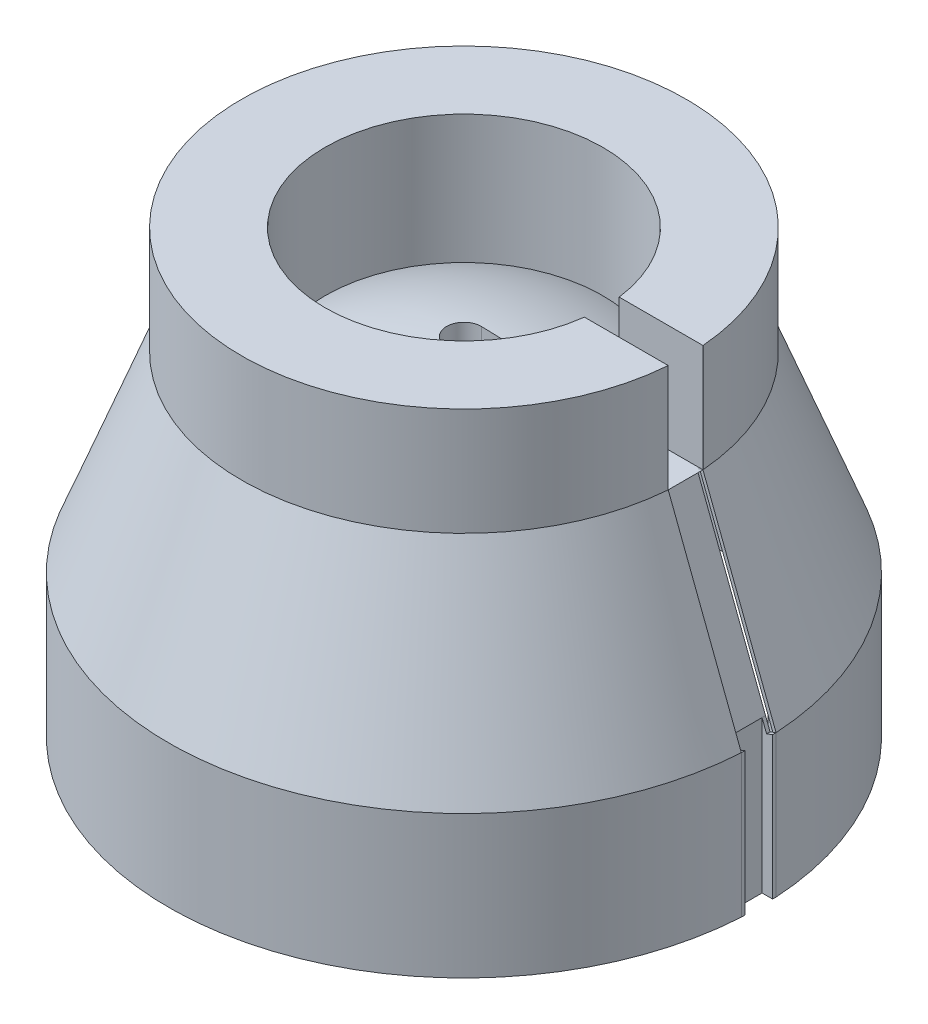
from build123d import *

# Parameters (mm, degrees)
DOME4_FACE_RADIUS        = 40
DOME4_HEIGHT             = 10
SKETCH4_R                = 5
SKETCH4_R_2              = 2.5
BOSS_EXTRUDE1_DEPTH      = 45
CIRPATTERN1_COUNT        = 4
SKETCH5_W                = 10
SKETCH5_H                = 31
CUT_EXTRUDE2_DEPTH       = 89.861003778
SKETCH6_W                = 24.118118898
SKETCH6_H                = 31
BOSS_EXTRUDE2_DEPTH      = 0.1
SKETCH7_W                = 24.118118898
SKETCH7_H                = 31
BOSS_EXTRUDE3_DEPTH      = 0.1
SKETCH8_W                = 45.166544076
SKETCH8_H                = 10
BOSS_EXTRUDE5_DEPTH      = 96
CUT_EXTRUDE13_DEPTH      = 20
SKETCH12_W               = 3.037052207
SKETCH12_H               = 10
CUT_EXTRUDE15_DEPTH      = 190
SKETCH13_W               = 10
SKETCH13_H               = 96
CUT_EXTRUDE16_DEPTH      = 190
BOSS_EXTRUDE7_DEPTH      = 1
BOSS_EXTRUDE9_DEPTH      = 1
CUT_EXTRUDE17_DEPTH      = 31
CUT_EXTRUDE17_DEPTH_BACK = 2
SKETCH17_W               = 10
SKETCH17_H               = 58.890017455
SKETCH18_R               = 5
CUT_EXTRUDE18_DEPTH      = 42
SKETCH19_R               = 33.381211514
SKETCH19_R_2             = 30.278223776
BOSS_EXTRUDE10_DEPTH     = 5
FILLET2_R                = 1


with BuildPart() as part:
    # Sketch1 → Revolve1 (revolve)
    with BuildSketch(Plane.XY, mode=Mode.PRIVATE) as revolve1_sk:
        Polygon((85, 0), (85, 41), (64, 96), (64, 127), (40, 127), (40, 90), (0, 90), (0, 89), (41, 89), (41, 126), (63, 126), (63, 95.815583613), (84, 40.815583613), (84, 0), align=None)
    revolve(revolve1_sk.sketch.rotate(Axis((0, 90, 0), (0, -1, 0)), 180), axis=Axis((0, 90, 0), (0, -1, 0)))

    # Dome4: a dome of height H over a round flat face of radius A is a cap of a sphere of radius (A * A + H * H) / (2 * H)
    dome4_r = (DOME4_FACE_RADIUS * DOME4_FACE_RADIUS + DOME4_HEIGHT * DOME4_HEIGHT) / (2 * DOME4_HEIGHT)
    dome4_base = Plane((0, 90, 0), z_dir=(0, 1, 0))
    with Locations(dome4_base.offset(DOME4_HEIGHT - dome4_r)):
        dome4_ball = Sphere(dome4_r, mode=Mode.PRIVATE)
    add(split(dome4_ball, bisect_by=dome4_base, keep=Keep.TOP, mode=Mode.PRIVATE))

    # Sketch4 → Boss-Extrude1 (add)
    with BuildSketch(Plane(origin=(0, 0, 0), x_dir=(1, 0, 0), z_dir=(0, 1, 0))):
        with Locations(Location((-75.114947985, -19.422245118, 0), (0, 0, 178.461021893))):
            Circle(SKETCH4_R)
        with Locations(Location((-75.114947985, -19.422245118, 0), (0, 0, 90))):
            Circle(SKETCH4_R_2, mode=Mode.SUBTRACT)
    boss_extrude1 = extrude(amount=BOSS_EXTRUDE1_DEPTH)

    # CirPattern1: Boss-Extrude1 ×4 about axis
    cirpattern1_axis = Axis((0, 0, 0), (0, 1, 0))
    for i in range(1, CIRPATTERN1_COUNT):
        add(boss_extrude1.rotate(cirpattern1_axis, i * 360 / CIRPATTERN1_COUNT))

    # Sketch5 → Cut-Extrude2 (cut)
    with BuildSketch(Plane(origin=(0, 0, 0), x_dir=(0, 0, -1), z_dir=(1, 0, 0))):
        with Locations((0, 111.5)):
            Rectangle(SKETCH5_W, SKETCH5_H)
    extrude(amount=CUT_EXTRUDE2_DEPTH, mode=Mode.SUBTRACT)

    # Sketch6 → Boss-Extrude2 (add)
    with BuildSketch(Plane(origin=(0, 0, 5), x_dir=(-1, 0, 0), z_dir=(0, 0, -1))):
        with Locations((-51.745329115, 111.5)):
            Rectangle(SKETCH6_W, SKETCH6_H)
    extrude(amount=-BOSS_EXTRUDE2_DEPTH)

    # Sketch7 → Boss-Extrude3 (add)
    with BuildSketch(Plane.XY.offset(-5)):
        with Locations((51.745329115, 111.5)):
            Rectangle(SKETCH7_W, SKETCH7_H)
    extrude(amount=-BOSS_EXTRUDE3_DEPTH)


with BuildPart() as body_2:
    # Sketch8 → Boss-Extrude5 (new body)
    with BuildSketch(Plane(origin=(0, 0, 0), x_dir=(1, 0, 0), z_dir=(0, 1, 0))):
        with Locations((62.269541704, 0)):
            Rectangle(SKETCH8_W, SKETCH8_H)
    extrude(amount=BOSS_EXTRUDE5_DEPTH)

    # Sketch11 → Cut-Extrude13 (cut)
    with BuildSketch(Plane(origin=(0, 0, -5), x_dir=(-1, 0, 0), z_dir=(0, 0, -1))):
        Polygon((-39.686269666, 67.139351032), (-75.426855006, 0), (-39.686269666, 0), align=None)
    extrude(amount=-CUT_EXTRUDE13_DEPTH, mode=Mode.SUBTRACT)


with BuildPart() as cut_extrude15_tool:
    # Sketch12 → Cut-Extrude15 (new body)
    with BuildSketch(Plane(origin=(0, 96, 0), x_dir=(1, 0, 0), z_dir=(0, 1, 0))):
        with Locations((83.334287639, 0)):
            Rectangle(SKETCH12_W, SKETCH12_H)
    extrude(amount=-CUT_EXTRUDE15_DEPTH)


with BuildPart() as part_1:
    add(part.part)

    # Cut-Extrude15: cut by cut_extrude15_tool
    add(cut_extrude15_tool.part, mode=Mode.SUBTRACT)

    # Sketch13 → Cut-Extrude16 (cut)
    with BuildSketch(Plane(origin=(81.815761535, 0, 0), x_dir=(0, 0, -1), z_dir=(1, 0, 0))):
        with Locations((0, 48)):
            Rectangle(SKETCH13_W, SKETCH13_H)
    extrude(amount=CUT_EXTRUDE16_DEPTH, mode=Mode.SUBTRACT)


with BuildPart() as body_2_1:
    add(body_2.part)

    # Cut-Extrude15: cut by cut_extrude15_tool
    add(cut_extrude15_tool.part, mode=Mode.SUBTRACT)


with BuildPart() as body_3:
    # Sketch14 → Boss-Extrude7 (new body)
    with BuildSketch(Plane(origin=(0, 0, 5), x_dir=(-1, 0, 0), z_dir=(0, 0, -1))):
        Polygon((-81.815761535, 48.939900976), (-84.852813742, 41), (-84.852813742, 0), (-81.815761535, 0), align=None)
    extrude(amount=BOSS_EXTRUDE7_DEPTH)


with BuildPart() as body_4:
    # Sketch15 → Boss-Extrude9 (new body)
    with BuildSketch(Plane.XY.offset(-5)):
        Polygon((81.815761535, 48.939900976), (84.852813742, 41), (84.852813742, 0), (81.815761535, 0), align=None)
    extrude(amount=BOSS_EXTRUDE9_DEPTH)


with BuildPart() as cut_extrude17_tool:
    # Sketch17 → Cut-Extrude17 (new, two sides: drawn at the far end of the back side and taken through both)
    with BuildSketch(Plane(origin=(87.847663012, 33.541834968, 0), x_dir=(0, 0, -1), z_dir=(0.9342183861793726, 0.35670156563212446, 0)).offset(-CUT_EXTRUDE17_DEPTH_BACK)):
        with Locations((0, 37.480831051)):
            Rectangle(SKETCH17_W, SKETCH17_H)
    extrude(amount=CUT_EXTRUDE17_DEPTH + CUT_EXTRUDE17_DEPTH_BACK)


with BuildPart() as part_2:
    add(part_1.part)

    # Cut-Extrude17: cut by cut_extrude17_tool
    add(cut_extrude17_tool.part, mode=Mode.SUBTRACT)

    # Sketch18 → Cut-Extrude18 (cut)
    with BuildSketch(Plane.XZ.offset(-89)):
        Circle(SKETCH18_R)
    extrude(amount=-CUT_EXTRUDE18_DEPTH, mode=Mode.SUBTRACT)

    # Sketch19 → Boss-Extrude10 (add)
    with BuildSketch(Plane.XZ.offset(-89)):
        with Locations(Location((0, 0, 0), (0, 0, 180))):
            Circle(SKETCH19_R)
        Circle(SKETCH19_R_2, mode=Mode.SUBTRACT)
    extrude(amount=BOSS_EXTRUDE10_DEPTH)

    # Fillet2
    fillet2_edges = [part_2.edges().sort_by_distance(p)[0] for p in [
        (33.381211514, 84, 0),
        (-30.278223776, 84, 0),
    ]]
    fillet(fillet2_edges, radius=FILLET2_R)


with BuildPart() as body_2_2:
    add(body_2_1.part)

    # Cut-Extrude17: cut by cut_extrude17_tool
    add(cut_extrude17_tool.part, mode=Mode.SUBTRACT)


with BuildPart() as body_3_1:
    add(body_3.part)

    # Cut-Extrude17: cut by cut_extrude17_tool
    add(cut_extrude17_tool.part, mode=Mode.SUBTRACT)


with BuildPart() as body_4_1:
    add(body_4.part)

    # Cut-Extrude17: cut by cut_extrude17_tool
    add(cut_extrude17_tool.part, mode=Mode.SUBTRACT)


solid = Compound([part_2.part, body_2_2.part, body_3_1.part, body_4_1.part])
